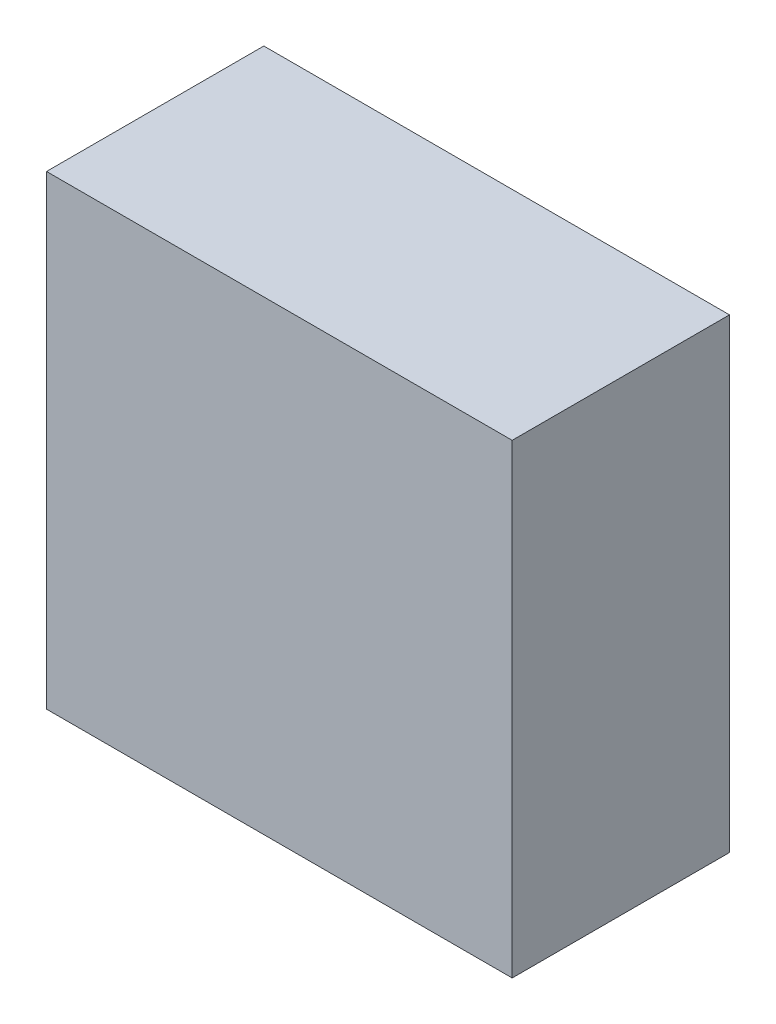
from build123d import *

# Parameters (mm, degrees)
SKETCH_1_W      = 75
SKETCH_1_H      = 75
EXTRUDE_1_DEPTH = 35


with BuildPart() as part:
    # ｽｹｯﾁ1 → ﾎﾞｽ - 押し出し1 (new body)
    with BuildSketch(Plane.XY):
        with Locations((37.5, 37.5)):
            Rectangle(SKETCH_1_W, SKETCH_1_H)
    extrude(amount=EXTRUDE_1_DEPTH)


solid = part.part
